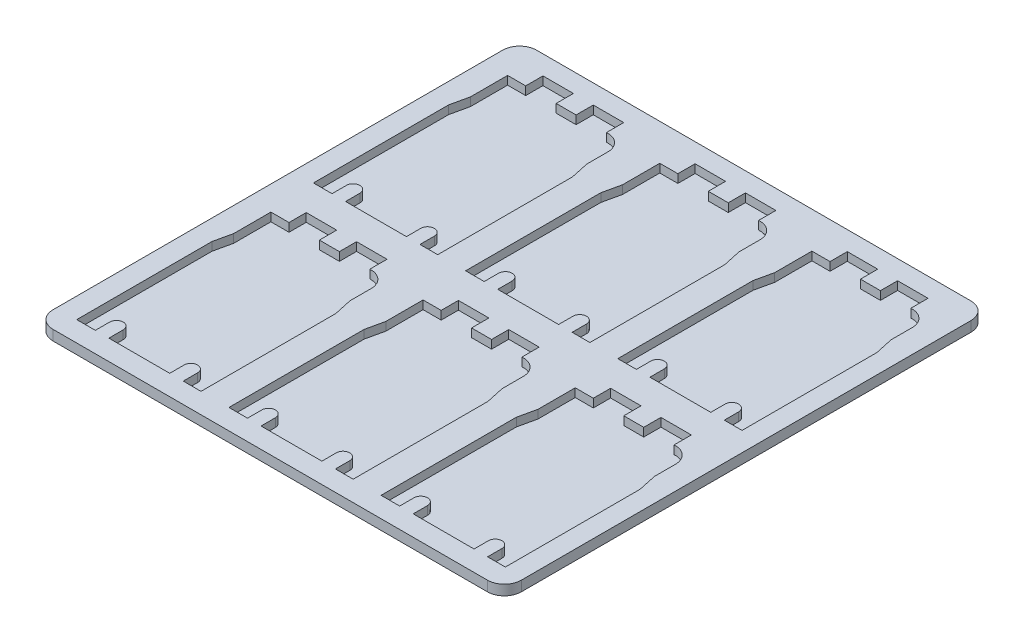
from build123d import *

# Parameters (mm, degrees)
BOSS_EXTRUDE1_DEPTH = 6
CUT_EXTRUDE1_DEPTH  = 5


with BuildPart() as part:
    # Sketch1 → Boss-Extrude1 (new body)
    with BuildSketch(Plane(origin=(0, 0, 0), x_dir=(1, 0, 0), z_dir=(0, 1, 0))):
        with BuildLine():
            Line((10, 0), (267, 0))
            ThreePointArc((267, 0), (274.071067812, 2.928932188), (277, 10))
            Line((277, 10), (277, 276))
            ThreePointArc((277, 276), (274.071067812, 283.071067812), (267, 286))
            Line((267, 286), (10, 286))
            ThreePointArc((10, 286), (2.928932188, 283.071067812), (0, 276))
            Line((0, 276), (0, 10))
            ThreePointArc((0, 10), (2.928932188, 2.928932188), (10, 0))
        make_face()
    extrude(amount=BOSS_EXTRUDE1_DEPTH)

    # Sketch2 → Cut-Extrude1 (cut)
    with BuildSketch(Plane(origin=(0, 6, 0), x_dir=(1, 0, 0), z_dir=(0, 1, 0))):
        with BuildLine():
            Line((12.062245302, 92), (14.402743297, 102.5))
            Line((14.402743297, 102.5), (14.402743297, 124.5))
            Line((14.402743297, 124.5), (25.102743297, 124.5))
            Line((25.102743297, 124.5), (25.102743297, 134.7))
            Line((25.102743297, 134.7), (43.102743297, 134.7))
            Line((43.102743297, 134.7), (43.102743297, 124.5))
            Line((43.102743297, 124.5), (54.902731898, 124.5))
            Line((54.902731898, 124.5), (54.902731898, 134.663480988))
            Line((54.902731898, 134.663480988), (72.902731898, 134.663480988))
            Line((72.902731898, 134.663480988), (72.902731898, 124.463480988))
            ThreePointArc((72.902731898, 124.463480988), (80.333662874, 121.834216678), (83.221747307, 114.5))
            Line((83.221747307, 114.5), (83.221747307, 102.5))
            Line((83.221747307, 102.5), (85.562245302, 91.74))
            Line((85.562245302, 91.74), (85.562245302, 12))
            Line((85.562245302, 12), (75.062245302, 12))
            Line((75.062245302, 12), (75.062245302, 20.5))
            ThreePointArc((75.062245302, 20.5), (71.062245302, 24.5), (67.062245302, 20.5))
            Line((67.062245302, 20.5), (67.062245302, 12))
            Line((67.062245302, 12), (31.062245302, 12))
            Line((31.062245302, 12), (31.062245302, 20.5))
            ThreePointArc((31.062245302, 20.5), (27.062245302, 24.5), (23.062245302, 20.5))
            Line((23.062245302, 20.5), (23.062245302, 12))
            Line((23.062245302, 12), (12.062245302, 12))
            Line((12.062245302, 12), (12.062245302, 92))
        make_face()
        with BuildLine():
            Line((102.062245302, 92), (104.402743297, 102.5))
            Line((104.402743297, 102.5), (104.402743297, 124.5))
            Line((104.402743297, 124.5), (115.102743297, 124.5))
            Line((115.102743297, 124.5), (115.102743297, 134.7))
            Line((115.102743297, 134.7), (133.102743297, 134.7))
            Line((133.102743297, 134.7), (133.102743297, 124.5))
            Line((133.102743297, 124.5), (144.902731898, 124.5))
            Line((144.902731898, 124.5), (144.902731898, 134.663480988))
            Line((144.902731898, 134.663480988), (162.902731898, 134.663480988))
            Line((162.902731898, 134.663480988), (162.902731898, 124.463480988))
            ThreePointArc((162.902731898, 124.463480988), (170.333662874, 121.834216678), (173.221747307, 114.5))
            Line((173.221747307, 114.5), (173.221747307, 102.5))
            Line((173.221747307, 102.5), (175.562245302, 91.74))
            Line((175.562245302, 91.74), (175.562245302, 12))
            Line((175.562245302, 12), (165.062245302, 12))
            Line((165.062245302, 12), (165.062245302, 20.5))
            ThreePointArc((165.062245302, 20.5), (161.062245302, 24.5), (157.062245302, 20.5))
            Line((157.062245302, 20.5), (157.062245302, 12))
            Line((157.062245302, 12), (121.062245302, 12))
            Line((121.062245302, 12), (121.062245302, 20.5))
            ThreePointArc((121.062245302, 20.5), (117.062245302, 24.5), (113.062245302, 20.5))
            Line((113.062245302, 20.5), (113.062245302, 12))
            Line((113.062245302, 12), (102.062245302, 12))
            Line((102.062245302, 12), (102.062245302, 92))
        make_face()
        with BuildLine():
            Line((192.062245302, 92), (194.402743297, 102.5))
            Line((194.402743297, 102.5), (194.402743297, 124.5))
            Line((194.402743297, 124.5), (205.102743297, 124.5))
            Line((205.102743297, 124.5), (205.102743297, 134.7))
            Line((205.102743297, 134.7), (223.102743297, 134.7))
            Line((223.102743297, 134.7), (223.102743297, 124.5))
            Line((223.102743297, 124.5), (234.902731898, 124.5))
            Line((234.902731898, 124.5), (234.902731898, 134.663480988))
            Line((234.902731898, 134.663480988), (252.902731898, 134.663480988))
            Line((252.902731898, 134.663480988), (252.902731898, 124.463480988))
            ThreePointArc((252.902731898, 124.463480988), (260.333662874, 121.834216678), (263.221747307, 114.5))
            Line((263.221747307, 114.5), (263.221747307, 102.5))
            Line((263.221747307, 102.5), (265.562245302, 91.74))
            Line((265.562245302, 91.74), (265.562245302, 12))
            Line((265.562245302, 12), (255.062245302, 12))
            Line((255.062245302, 12), (255.062245302, 20.5))
            ThreePointArc((255.062245302, 20.5), (251.062245302, 24.5), (247.062245302, 20.5))
            Line((247.062245302, 20.5), (247.062245302, 12))
            Line((247.062245302, 12), (211.062245302, 12))
            Line((211.062245302, 12), (211.062245302, 20.5))
            ThreePointArc((211.062245302, 20.5), (207.062245302, 24.5), (203.062245302, 20.5))
            Line((203.062245302, 20.5), (203.062245302, 12))
            Line((203.062245302, 12), (192.062245302, 12))
            Line((192.062245302, 12), (192.062245302, 92))
        make_face()
        with BuildLine():
            Line((102.062245302, 232), (104.402743297, 242.5))
            Line((104.402743297, 242.5), (104.402743297, 264.5))
            Line((104.402743297, 264.5), (115.102743297, 264.5))
            Line((115.102743297, 264.5), (115.102743297, 274.7))
            Line((115.102743297, 274.7), (133.102743297, 274.7))
            Line((133.102743297, 274.7), (133.102743297, 264.5))
            Line((133.102743297, 264.5), (144.902731898, 264.5))
            Line((144.902731898, 264.5), (144.902731898, 274.663480988))
            Line((144.902731898, 274.663480988), (162.902731898, 274.663480988))
            Line((162.902731898, 274.663480988), (162.902731898, 264.463480988))
            ThreePointArc((162.902731898, 264.463480988), (170.333662874, 261.834216678), (173.221747307, 254.5))
            Line((173.221747307, 254.5), (173.221747307, 242.5))
            Line((173.221747307, 242.5), (175.562245302, 231.74))
            Line((175.562245302, 231.74), (175.562245302, 152))
            Line((175.562245302, 152), (165.062245302, 152))
            Line((165.062245302, 152), (165.062245302, 160.5))
            ThreePointArc((165.062245302, 160.5), (161.062245302, 164.5), (157.062245302, 160.5))
            Line((157.062245302, 160.5), (157.062245302, 152))
            Line((157.062245302, 152), (121.062245302, 152))
            Line((121.062245302, 152), (121.062245302, 160.5))
            ThreePointArc((121.062245302, 160.5), (117.062245302, 164.5), (113.062245302, 160.5))
            Line((113.062245302, 160.5), (113.062245302, 152))
            Line((113.062245302, 152), (102.062245302, 152))
            Line((102.062245302, 152), (102.062245302, 232))
        make_face()
        with BuildLine():
            Line((192.062245302, 232), (194.402743297, 242.5))
            Line((194.402743297, 242.5), (194.402743297, 264.5))
            Line((194.402743297, 264.5), (205.102743297, 264.5))
            Line((205.102743297, 264.5), (205.102743297, 274.7))
            Line((205.102743297, 274.7), (223.102743297, 274.7))
            Line((223.102743297, 274.7), (223.102743297, 264.5))
            Line((223.102743297, 264.5), (234.902731898, 264.5))
            Line((234.902731898, 264.5), (234.902731898, 274.663480988))
            Line((234.902731898, 274.663480988), (252.902731898, 274.663480988))
            Line((252.902731898, 274.663480988), (252.902731898, 264.463480988))
            ThreePointArc((252.902731898, 264.463480988), (260.333662874, 261.834216678), (263.221747307, 254.5))
            Line((263.221747307, 254.5), (263.221747307, 242.5))
            Line((263.221747307, 242.5), (265.562245302, 231.74))
            Line((265.562245302, 231.74), (265.562245302, 152))
            Line((265.562245302, 152), (255.062245302, 152))
            Line((255.062245302, 152), (255.062245302, 160.5))
            ThreePointArc((255.062245302, 160.5), (251.062245302, 164.5), (247.062245302, 160.5))
            Line((247.062245302, 160.5), (247.062245302, 152))
            Line((247.062245302, 152), (211.062245302, 152))
            Line((211.062245302, 152), (211.062245302, 160.5))
            ThreePointArc((211.062245302, 160.5), (207.062245302, 164.5), (203.062245302, 160.5))
            Line((203.062245302, 160.5), (203.062245302, 152))
            Line((203.062245302, 152), (192.062245302, 152))
            Line((192.062245302, 152), (192.062245302, 232))
        make_face()
        with BuildLine():
            Line((12.062245302, 232), (14.402743297, 242.5))
            Line((14.402743297, 242.5), (14.402743297, 264.5))
            Line((14.402743297, 264.5), (25.102743297, 264.5))
            Line((25.102743297, 264.5), (25.102743297, 274.7))
            Line((25.102743297, 274.7), (43.102743297, 274.7))
            Line((43.102743297, 274.7), (43.102743297, 264.5))
            Line((43.102743297, 264.5), (54.902731898, 264.5))
            Line((54.902731898, 264.5), (54.902731898, 274.663480988))
            Line((54.902731898, 274.663480988), (72.902731898, 274.663480988))
            Line((72.902731898, 274.663480988), (72.902731898, 264.463480988))
            ThreePointArc((72.902731898, 264.463480988), (80.333662874, 261.834216678), (83.221747307, 254.5))
            Line((83.221747307, 254.5), (83.221747307, 242.5))
            Line((83.221747307, 242.5), (85.562245302, 231.74))
            Line((85.562245302, 231.74), (85.562245302, 152))
            Line((85.562245302, 152), (75.062245302, 152))
            Line((75.062245302, 152), (75.062245302, 160.5))
            ThreePointArc((75.062245302, 160.5), (71.062245302, 164.5), (67.062245302, 160.5))
            Line((67.062245302, 160.5), (67.062245302, 152))
            Line((67.062245302, 152), (31.062245302, 152))
            Line((31.062245302, 152), (31.062245302, 160.5))
            ThreePointArc((31.062245302, 160.5), (27.062245302, 164.5), (23.062245302, 160.5))
            Line((23.062245302, 160.5), (23.062245302, 152))
            Line((23.062245302, 152), (12.062245302, 152))
            Line((12.062245302, 152), (12.062245302, 232))
        make_face()
    extrude(amount=-CUT_EXTRUDE1_DEPTH, mode=Mode.SUBTRACT)


solid = part.part
